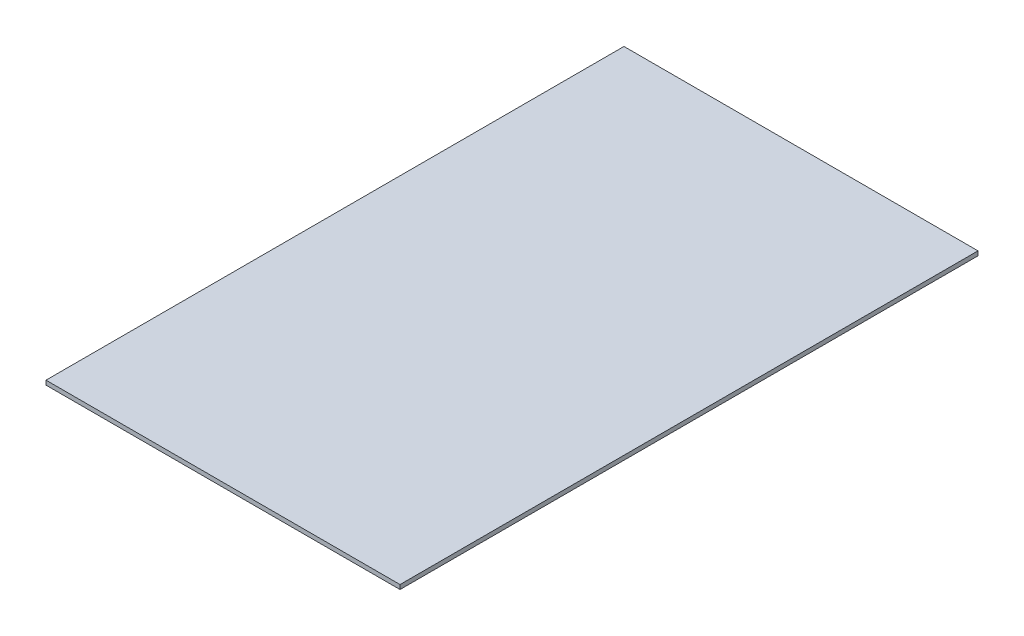
from build123d import *

# Parameters (mm, degrees)
SKETCH2_W           = 245
SKETCH2_H           = 400
BOSS_EXTRUDE1_DEPTH = 3


with BuildPart() as part:
    # Sketch2 → Boss-Extrude1 (new body)
    with BuildSketch(Plane(origin=(0, 0, 0), x_dir=(1, 0, 0), z_dir=(0, 1, 0))):
        with Locations((122.5, 200)):
            Rectangle(SKETCH2_W, SKETCH2_H)
    extrude(amount=BOSS_EXTRUDE1_DEPTH)


solid = part.part
